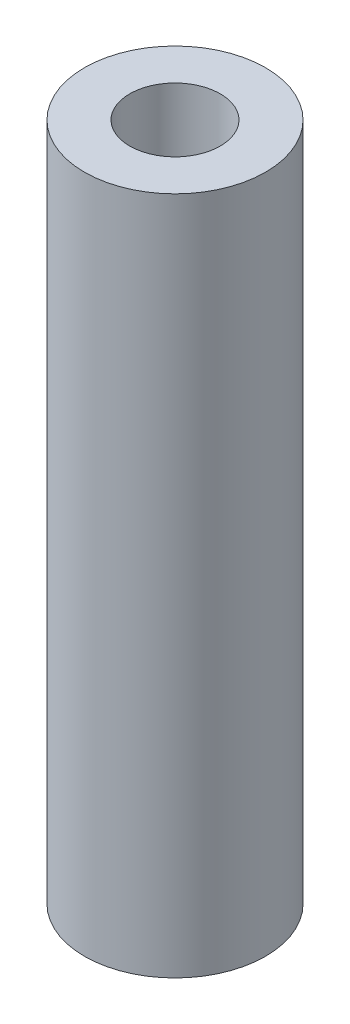
from build123d import *

# Parameters (mm, degrees)
SKETCH1_R           = 4
SKETCH1_R_2         = 2
BOSS_EXTRUDE1_DEPTH = 30


with BuildPart() as part:
    # Sketch1 → Boss-Extrude1 (new body)
    with BuildSketch(Plane(origin=(0, 0, 0), x_dir=(1, 0, 0), z_dir=(0, 1, 0))):
        with Locations(Location((0, 0, 0), (0, 0, 270))):
            Circle(SKETCH1_R)
        with Locations(Location((0, 0, 0), (0, 0, 270))):
            Circle(SKETCH1_R_2, mode=Mode.SUBTRACT)
    extrude(amount=BOSS_EXTRUDE1_DEPTH)


solid = part.part
